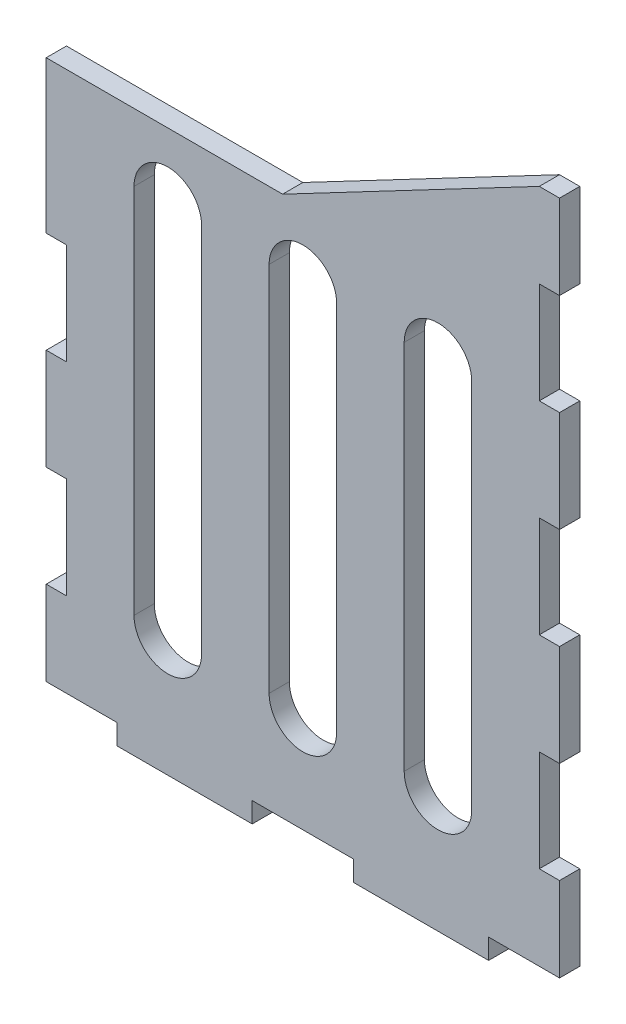
from build123d import *

# Parameters (mm, degrees)
BOSS_EXTRUDE1_DEPTH = 3


with BuildPart() as part:
    # Sketch1 → Boss-Extrude1 (new body)
    with BuildSketch(Plane.XY):
        Polygon((35, 50), (-3, 30), (-38, 30), (-38, 7.5), (-35, 7.5), (-35, -7.5), (-38, -7.5), (-38, -22.5), (-35, -22.5), (-35, -37.5), (-38, -37.5), (-38, -50), (-27.5, -50), (-27.5, -53), (-7.5, -53), (-7.5, -50), (7.5, -50), (7.5, -53), (27.5, -53), (27.5, -50), (38, -50), (38, -37.5), (35, -37.5), (35, -22.5), (38, -22.5), (38, -7.5), (35, -7.5), (35, 7.5), (38, 7.5), (38, 22.5), (35, 22.5), (35, 37.5), (38, 37.5), (38, 50), align=None)
        with BuildLine():
            Line((-15, 20), (-15, -35))
            ThreePointArc((-15, -35), (-20, -40), (-25, -35))
            Line((-25, -35), (-25, 20))
            ThreePointArc((-25, 20), (-20, 25), (-15, 20))
        make_face(mode=Mode.SUBTRACT)
        with BuildLine():
            ThreePointArc((5, -35), (0, -40), (-5, -35))
            Line((-5, -35), (-5, 20))
            ThreePointArc((-5, 20), (0, 25), (5, 20))
            Line((5, 20), (5, -35))
        make_face(mode=Mode.SUBTRACT)
        with BuildLine():
            ThreePointArc((25, -35), (20, -40), (15, -35))
            Line((15, -35), (15, 20))
            ThreePointArc((15, 20), (20, 25), (25, 20))
            Line((25, 20), (25, -35))
        make_face(mode=Mode.SUBTRACT)
    extrude(amount=BOSS_EXTRUDE1_DEPTH)


solid = part.part
